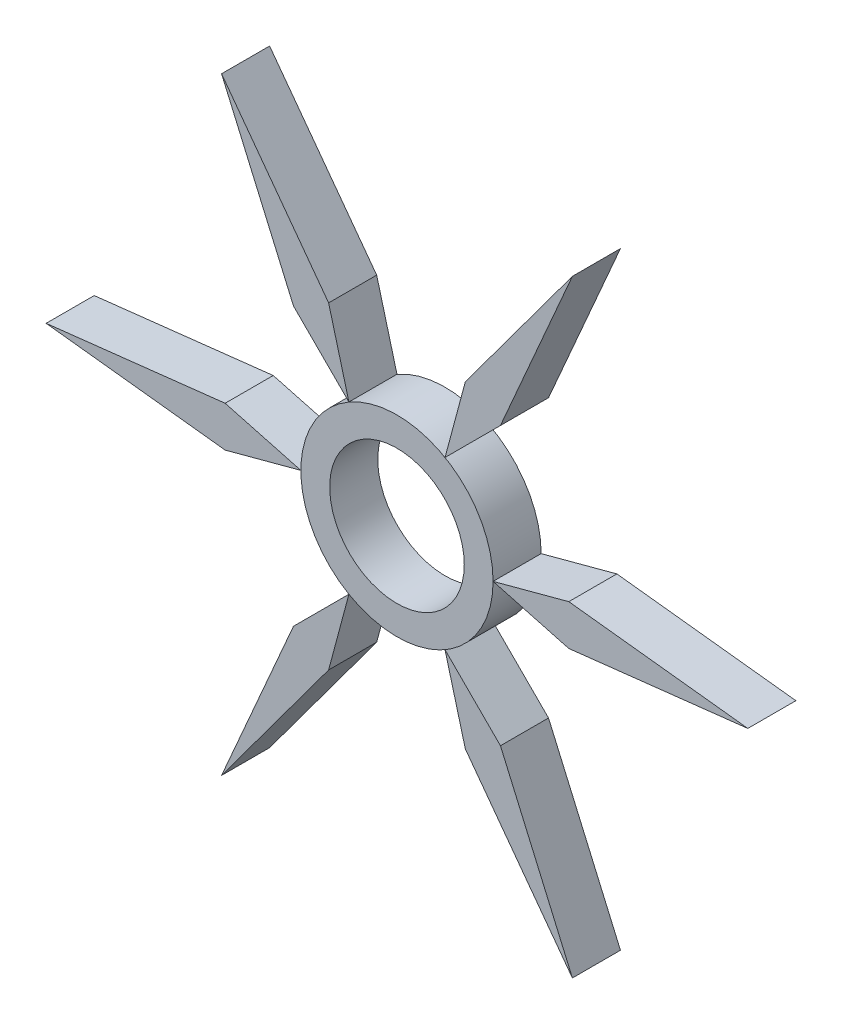
from build123d import *

# Parameters (mm, degrees)
SKETCH1_R             = 20
SKETCH1_R_2           = 14
BOSS_EXTRUDE1_DEPTH   = 5
BOSS_EXTRUDE1_2_DEPTH = 5
BOSS_EXTRUDE1_3_DEPTH = 5
BOSS_EXTRUDE1_4_DEPTH = 5
BOSS_EXTRUDE1_5_DEPTH = 5
BOSS_EXTRUDE1_6_DEPTH = 5
BOSS_EXTRUDE1_7_DEPTH = 5


with BuildPart() as part:
    # Sketch1 → Boss-Extrude1 (new, symmetric)
    with BuildSketch(Plane.XY):
        Circle(SKETCH1_R)
        Circle(SKETCH1_R_2, mode=Mode.SUBTRACT)
    extrude(amount=BOSS_EXTRUDE1_DEPTH, both=True)


with BuildPart() as body_2:
    # Sketch1 → Boss-Extrude1 2 (new, symmetric)
    with BuildSketch(Plane.XY):
        Polygon((-10, -17.320508076), (-14.220662617, -33.072235406), (-36.5, -63.219854476), (-21.531064712, -28.851572788), align=None)
    extrude(amount=BOSS_EXTRUDE1_2_DEPTH, both=True)


with BuildPart() as body_3:
    # Sketch1 → Boss-Extrude1 3 (new, symmetric)
    with BuildSketch(Plane.XY):
        Polygon((10, -17.320508076), (21.531064712, -28.851572788), (36.5, -63.219854476), (14.220662617, -33.072235406), align=None)
    extrude(amount=BOSS_EXTRUDE1_3_DEPTH, both=True)


with BuildPart() as body_4:
    # Sketch1 → Boss-Extrude1 4 (new, symmetric)
    with BuildSketch(Plane.XY):
        Polygon((-10, 17.320508076), (-14.220662617, 33.072235406), (-36.5, 63.219854476), (-21.531064712, 28.851572788), align=None)
    extrude(amount=BOSS_EXTRUDE1_4_DEPTH, both=True)


with BuildPart() as body_5:
    # Sketch1 → Boss-Extrude1 5 (new, symmetric)
    with BuildSketch(Plane.XY):
        Polygon((-35.75172733, 4.220662617), (-73, 0), (-35.75172733, -4.220662617), (-20, 0), align=None)
    extrude(amount=BOSS_EXTRUDE1_5_DEPTH, both=True)


with BuildPart() as body_6:
    # Sketch1 → Boss-Extrude1 6 (new, symmetric)
    with BuildSketch(Plane.XY):
        Polygon((35.75172733, 4.220662617), (73, 0), (35.75172733, -4.220662617), (20, 0), align=None)
    extrude(amount=BOSS_EXTRUDE1_6_DEPTH, both=True)


with BuildPart() as body_7:
    # Sketch1 → Boss-Extrude1 7 (new, symmetric)
    with BuildSketch(Plane.XY):
        Polygon((21.531064712, 28.851572788), (36.5, 63.219854476), (14.220662617, 33.072235406), (10, 17.320508076), align=None)
    extrude(amount=BOSS_EXTRUDE1_7_DEPTH, both=True)


solid = Compound([part.part, body_2.part, body_3.part, body_4.part, body_5.part, body_6.part, body_7.part])
